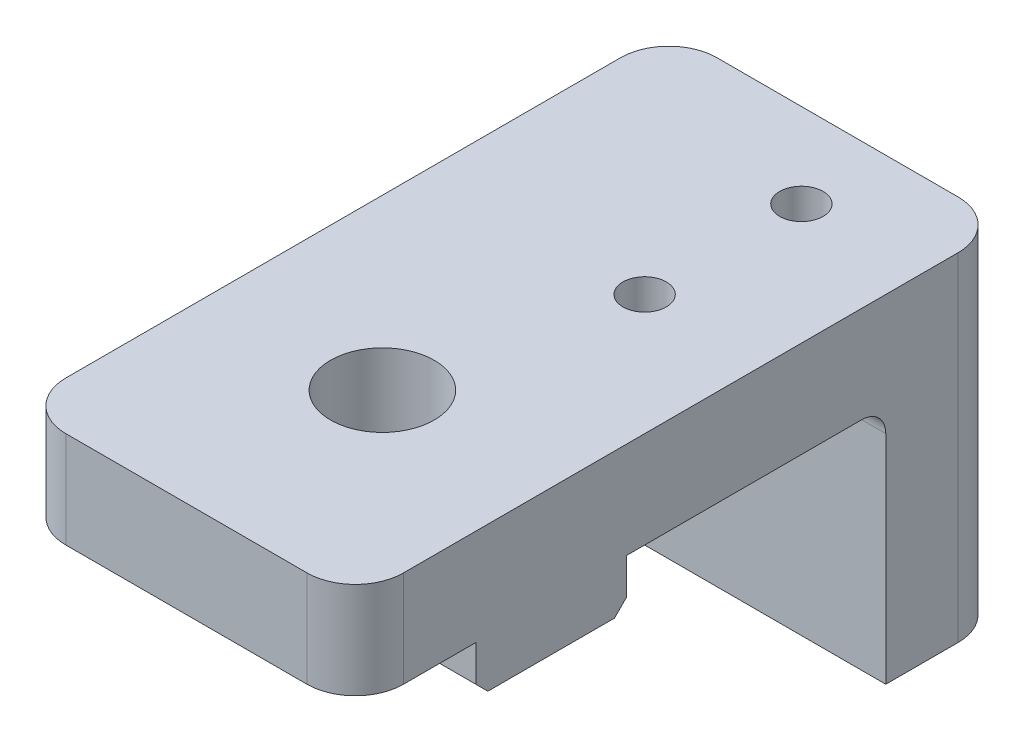
from build123d import *

# Parameters (mm, degrees)
SKETCH2_W           = 14
SKETCH2_H           = 22
SKETCH2_H_2         = 5
BOSS_EXTRUDE1_DEPTH = 4
SKETCH4_W           = 14
SKETCH4_H           = 6.25
BOSS_EXTRUDE2_DEPTH = 2
SKETCH3_R           = 0.9
SKETCH3_R_2         = 2.15
CUT_EXTRUDE1_DEPTH  = 27.758176321
CHAMFER1_SIZE       = 0.5
FILLET1_R           = 2
CUT_EXTRUDE2_REACH  = 28.758
SKETCH5_W           = 9
SKETCH5_H           = 6.25
BOSS_EXTRUDE3_DEPTH = 10
SKETCH7_W           = 3.5
SKETCH7_H           = 1.5
FILLET2_R           = 1


with BuildPart() as part:
    # Sketch2 → Boss-Extrude1 (new body)
    with BuildSketch(Plane(origin=(0, 0, 0), x_dir=(1, 0, 0), z_dir=(0, 1, 0))):
        with Locations((7, 11)):
            Rectangle(SKETCH2_W, SKETCH2_H)
        with Locations((7, -2.5)):
            Rectangle(SKETCH2_W, SKETCH2_H_2)
    extrude(amount=BOSS_EXTRUDE1_DEPTH)

    # Sketch4 → Boss-Extrude2 (add)
    with BuildSketch(Plane(origin=(0, 0, 0), x_dir=(-1, 0, 0), z_dir=(0, -1, 0))):
        with Locations((-7, 3.125)):
            Rectangle(SKETCH4_W, SKETCH4_H)
    extrude(amount=BOSS_EXTRUDE2_DEPTH)

    # Sketch3 → Cut-Extrude1 (cut, through all)
    with BuildSketch(Plane(origin=(0, 4, 0), x_dir=(1, 0, 0), z_dir=(0, 1, 0))):
        with Locations(Location((9, 18.5, 0), (0, 0, 180))):
            Circle(SKETCH3_R)
        with Locations(Location((9, 12, 0), (0, 0, 180))):
            Circle(SKETCH3_R)
        with Locations(Location((7, 3.125, 0), (0, 0, 180))):
            Circle(SKETCH3_R_2)
    extrude(amount=-CUT_EXTRUDE1_DEPTH, mode=Mode.SUBTRACT)

    # Chamfer1
    chamfer1_edges = [part.edges().sort_by_distance(p)[0] for p in [
        (7, -2, -6.25),
        (7, -2, 0),
    ]]
    chamfer(chamfer1_edges, length=CHAMFER1_SIZE)

    # Fillet1
    fillet1_edges = [part.edges().sort_by_distance(p)[0] for p in [
        (0, 2, -22),
        (14, 2, -22),
        (14, 2, 5),
        (0, 2, 5),
    ]]
    fillet(fillet1_edges, radius=FILLET1_R)

    # Cut-Extrude2: up to this face of the body (flat: up to its plane)
    cut_extrude2_end = Plane(part.part.faces().sort_by_distance((6.952367547, 0, -14.038528118))[0])
    # Sketch5 → Cut-Extrude2 (cut, up to the picked face)
    with BuildSketch(Plane.XZ.offset(2), mode=Mode.PRIVATE) as cut_extrude2_sk1:
        with Locations((7, -3.125)):
            Rectangle(SKETCH5_W, SKETCH5_H)
    cut_extrude2_tool1 = split(extrude(cut_extrude2_sk1.sketch, amount=-CUT_EXTRUDE2_REACH, mode=Mode.PRIVATE), bisect_by=cut_extrude2_end, keep=Keep.BOTH, mode=Mode.PRIVATE)
    add(cut_extrude2_tool1.solids().sort_by(Axis((7, -2, -3.125), (0, 1, 0)))[0], mode=Mode.SUBTRACT)

    # Sketch6 → Boss-Extrude3 (add)
    with BuildSketch(Plane.XZ):
        with BuildLine():
            Line((0, -17), (0, -20))
            ThreePointArc((0, -20), (0.585786438, -21.414213562), (2, -22))
            Line((2, -22), (12, -22))
            ThreePointArc((12, -22), (13.414213562, -21.414213562), (14, -20))
            Line((14, -20), (14, -17))
            Line((14, -17), (0, -17))
        make_face()
    extrude(amount=BOSS_EXTRUDE3_DEPTH)

    # Sketch7 → Cut-Revolve1 (revolve, cut)
    with BuildSketch(Plane(origin=(0, 0, -22), x_dir=(-1, 0, 0), z_dir=(0, 0, -1))):
        with Locations((-7, 0)):
            Rectangle(SKETCH7_W, SKETCH7_H)
    revolve(axis=Axis((14, -3, -22), (-1, 0, 0)), mode=Mode.SUBTRACT)

    # Fillet2
    fillet2_edges = [part.edges().sort_by_distance(p)[0] for p in [
        (7, 0, -17),
    ]]
    fillet(fillet2_edges, radius=FILLET2_R)


solid = part.part
